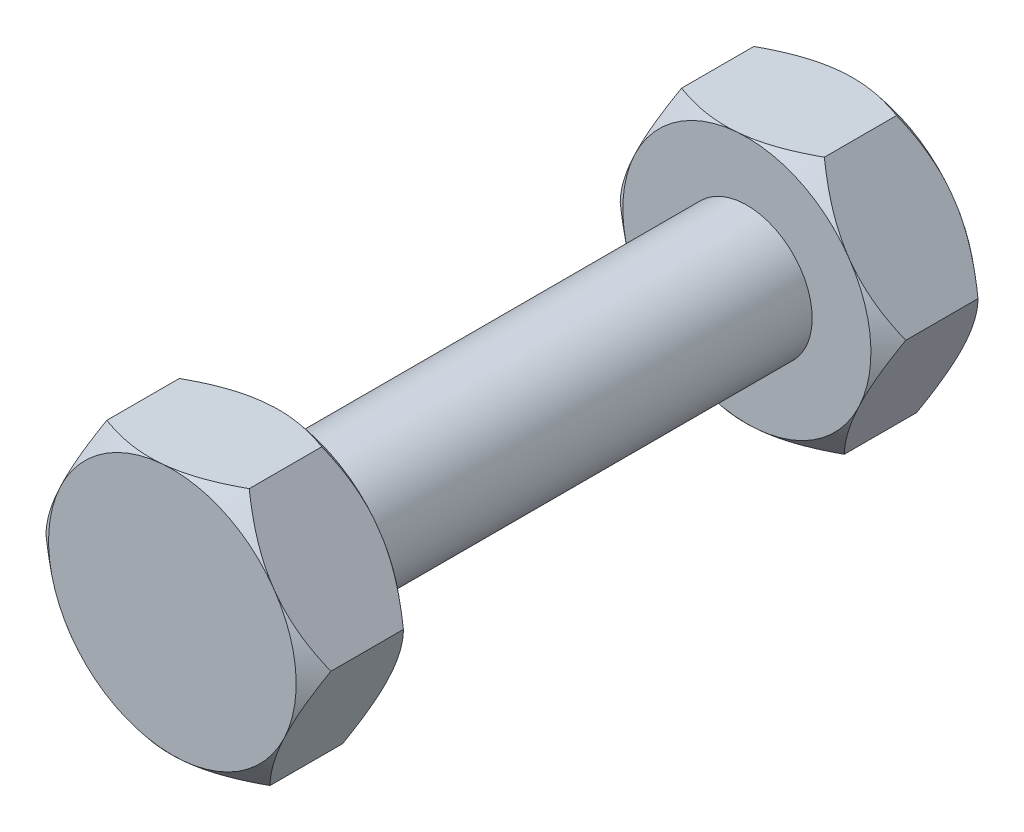
from build123d import *

# Parameters (mm, degrees)
SKETCH1_R           = 6
BOSS_EXTRUDE1_DEPTH = 36
BOSS_EXTRUDE2_DEPTH = 8
SKETCH3_OUTSIDE_W   = 53.532
SKETCH3_OUTSIDE_H   = 51.488
SKETCH3_OUTSIDE_R   = 9.5
CUT_EXTRUDE1_DEPTH  = 8
CUT_EXTRUDE1_DRAFT  = -50
SKETCH4_OUTSIDE_W   = 53.532
SKETCH4_OUTSIDE_H   = 51.488
SKETCH4_OUTSIDE_R   = 9.5
CUT_EXTRUDE3_DEPTH  = 8
CUT_EXTRUDE3_DRAFT  = -50
BOSS_EXTRUDE3_DEPTH = 8
SKETCH6_OUTSIDE_W   = 54.894
SKETCH6_OUTSIDE_H   = 52.85
SKETCH6_OUTSIDE_R   = 9.5
CUT_EXTRUDE6_DEPTH  = 8
CUT_EXTRUDE6_DRAFT  = -50
SKETCH7_OUTSIDE_W   = 54.894
SKETCH7_OUTSIDE_H   = 52.85
SKETCH7_OUTSIDE_R   = 9.481063721
CUT_EXTRUDE7_DEPTH  = 8
CUT_EXTRUDE7_DRAFT  = -50
SKETCH8_R           = 6
SKETCH8_R_2         = 5
CUT_EXTRUDE8_DEPTH  = 36


with BuildPart() as part:
    # Sketch1 → Boss-Extrude1 (new body)
    with BuildSketch(Plane.XY):
        Circle(SKETCH1_R)
    extrude(amount=BOSS_EXTRUDE1_DEPTH)

    # Sketch2 → Boss-Extrude2 (add)
    with BuildSketch(Plane(origin=(0, 0, 0), x_dir=(-1, 0, 0), z_dir=(0, 0, -1))):
        Polygon((-10.93381737, 0.885985919), (-6.234194998, -9.025970644), (4.699622372, -9.911956562), (10.93381737, -0.885985919), (6.234194998, 9.025970644), (-4.699622372, 9.911956562), align=None)
    extrude(amount=BOSS_EXTRUDE2_DEPTH)


with BuildPart() as cut_extrude1_tool:
    # Sketch3 outside → Cut-Extrude1 (with draft: the straight prism first)
    with BuildSketch(Plane.XY):
        Rectangle(SKETCH3_OUTSIDE_W, SKETCH3_OUTSIDE_H)
        Circle(SKETCH3_OUTSIDE_R, mode=Mode.SUBTRACT)
    extrude(amount=-CUT_EXTRUDE1_DEPTH)
    # Cut-Extrude1: the draft: its side faces are tilted about the plane it starts from
    cut_extrude1_sides = [cut_extrude1_tool.faces().sort_by_distance(p)[0] for p in [
        (0, -25.744, -4),
        (26.766, 0, -4),
        (0, 25.744, -4),
        (-26.766, 0, -4),
        (-9.5, 0, -4),
    ]]
    draft(cut_extrude1_sides, Plane.XY, CUT_EXTRUDE1_DRAFT)


with BuildPart() as part_1:
    add(part.part)

    # Cut-Extrude1: cut by cut_extrude1_tool
    add(cut_extrude1_tool.part, mode=Mode.SUBTRACT)


with BuildPart() as cut_extrude3_tool:
    # Sketch4 outside → Cut-Extrude3 (with draft: the straight prism first)
    with BuildSketch(Plane(origin=(0, 0, -8), x_dir=(-1, 0, 0), z_dir=(0, 0, -1))):
        Rectangle(SKETCH4_OUTSIDE_W, SKETCH4_OUTSIDE_H)
        Circle(SKETCH4_OUTSIDE_R, mode=Mode.SUBTRACT)
    extrude(amount=-CUT_EXTRUDE3_DEPTH)
    # Cut-Extrude3: the draft: its side faces are tilted about the plane it starts from
    cut_extrude3_sides = [cut_extrude3_tool.faces().sort_by_distance(p)[0] for p in [
        (0, -25.744, -4),
        (-26.766, 0, -4),
        (0, 25.744, -4),
        (26.766, 0, -4),
        (9.5, 0, -4),
    ]]
    draft(cut_extrude3_sides, Plane(origin=(0, 0, -8), x_dir=(-1, 0, 0), z_dir=(0, 0, -1)), CUT_EXTRUDE3_DRAFT)


with BuildPart() as part_2:
    add(part_1.part)

    # Cut-Extrude3: cut by cut_extrude3_tool
    add(cut_extrude3_tool.part, mode=Mode.SUBTRACT)

    # Sketch5 → Boss-Extrude3 (add)
    with BuildSketch(Plane.XY.offset(36)):
        Polygon((-6.252986911, 8.986336688), (-10.908889314, -0.92207717), (-4.655902404, -9.908413858), (6.252986911, -8.986336688), (10.908889314, 0.92207717), (4.655902404, 9.908413858), align=None)
    extrude(amount=BOSS_EXTRUDE3_DEPTH)


with BuildPart() as cut_extrude6_tool:
    # Sketch6 outside → Cut-Extrude6 (with draft: the straight prism first)
    with BuildSketch(Plane(origin=(0, 0, 36), x_dir=(-1, 0, 0), z_dir=(0, 0, -1))):
        Rectangle(SKETCH6_OUTSIDE_W, SKETCH6_OUTSIDE_H)
        Circle(SKETCH6_OUTSIDE_R, mode=Mode.SUBTRACT)
    extrude(amount=-CUT_EXTRUDE6_DEPTH)
    # Cut-Extrude6: the draft: its side faces are tilted about the plane it starts from
    cut_extrude6_sides = [cut_extrude6_tool.faces().sort_by_distance(p)[0] for p in [
        (0, -26.425, 40),
        (-27.447, 0, 40),
        (0, 26.425, 40),
        (27.447, 0, 40),
        (9.5, 0, 40),
    ]]
    draft(cut_extrude6_sides, Plane(origin=(0, 0, 36), x_dir=(-1, 0, 0), z_dir=(0, 0, -1)), CUT_EXTRUDE6_DRAFT)


with BuildPart() as part_3:
    add(part_2.part)

    # Cut-Extrude6: cut by cut_extrude6_tool
    add(cut_extrude6_tool.part, mode=Mode.SUBTRACT)


with BuildPart() as cut_extrude7_tool:
    # Sketch7 outside → Cut-Extrude7 (with draft: the straight prism first)
    with BuildSketch(Plane.XY.offset(44)):
        Rectangle(SKETCH7_OUTSIDE_W, SKETCH7_OUTSIDE_H)
        Circle(SKETCH7_OUTSIDE_R, mode=Mode.SUBTRACT)
    extrude(amount=-CUT_EXTRUDE7_DEPTH)
    # Cut-Extrude7: the draft: its side faces are tilted about the plane it starts from
    cut_extrude7_sides = [cut_extrude7_tool.faces().sort_by_distance(p)[0] for p in [
        (0, -26.425, 40),
        (27.447, 0, 40),
        (0, 26.425, 40),
        (-27.447, 0, 40),
        (-9.481063721, 0, 40),
    ]]
    draft(cut_extrude7_sides, Plane.XY.offset(44), CUT_EXTRUDE7_DRAFT)


with BuildPart() as part_4:
    add(part_3.part)

    # Cut-Extrude7: cut by cut_extrude7_tool
    add(cut_extrude7_tool.part, mode=Mode.SUBTRACT)

    # Sketch8 → Cut-Extrude8 (cut)
    with BuildSketch(Plane.XY):
        Circle(SKETCH8_R)
        Circle(SKETCH8_R_2, mode=Mode.SUBTRACT)
    extrude(amount=CUT_EXTRUDE8_DEPTH, mode=Mode.SUBTRACT)


solid = part_4.part
